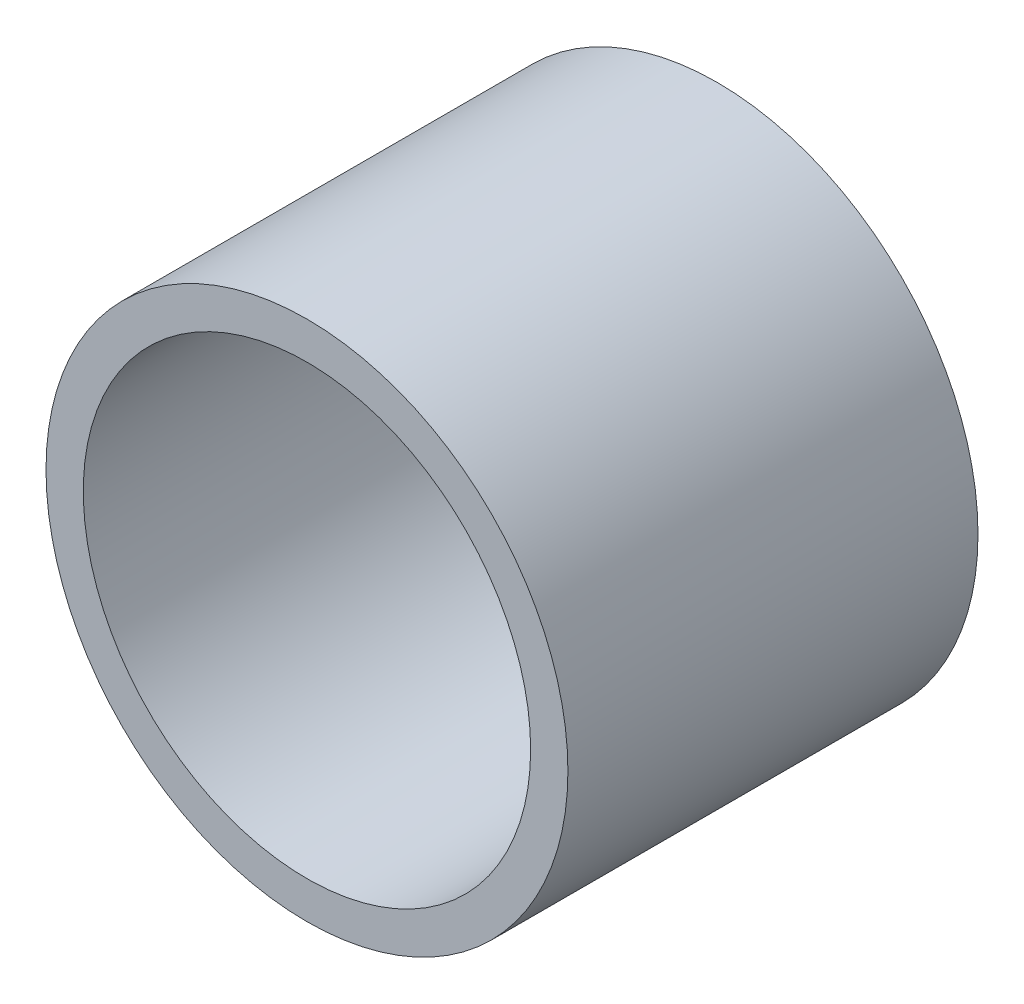
from build123d import *

# Parameters (mm, degrees)
SKETCH2_R           = 35
BOSS_EXTRUDE1_DEPTH = 27.5
SKETCH3_R           = 30
CUT_EXTRUDE1_DEPTH  = 74.993242935


with BuildPart() as part:
    # Sketch2 → Boss-Extrude1 (new, symmetric)
    with BuildSketch(Plane.XY):
        Circle(SKETCH2_R)
    extrude(amount=BOSS_EXTRUDE1_DEPTH, both=True)

    # Sketch3 → Cut-Extrude1 (cut, through all)
    with BuildSketch(Plane.XY.offset(27.5)):
        Circle(SKETCH3_R)
    extrude(amount=-CUT_EXTRUDE1_DEPTH, mode=Mode.SUBTRACT)


solid = part.part
